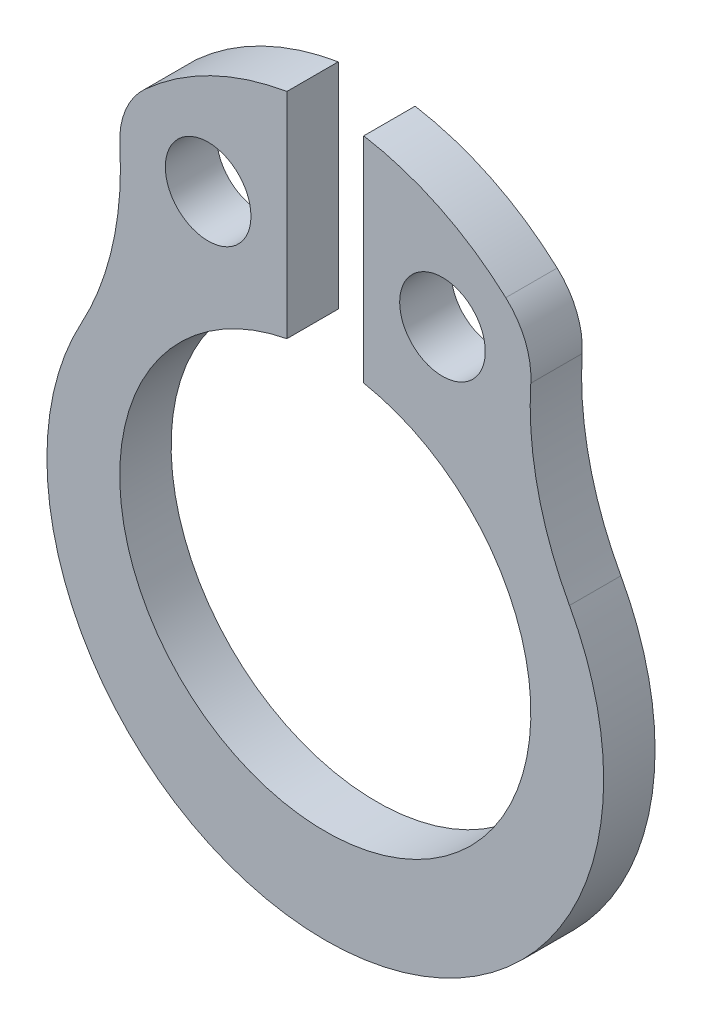
from build123d import *

# Parameters (mm, degrees)
SKETCH1_R           = 0.5
BOSS_EXTRUDE1_DEPTH = 0.3


with BuildPart() as part:
    # Sketch1 → Boss-Extrude1 (new, symmetric)
    with BuildSketch(Plane.XY):
        with BuildLine():
            Line((0.448644837, 4.857693324), (0.448644837, 2.357693324))
            ThreePointArc((0.448644837, 2.357693324), (0, -2.4), (-0.448644837, 2.357693324))
            Line((-0.448644837, 2.357693324), (-0.448644837, 4.857693324))
            ThreePointArc((-0.448644837, 4.857693324), (-1.335978352, 4.573676707), (-2.107001259, 4.050656745))
            ThreePointArc((-2.107001259, 4.050656745), (-2.334496109, 3.724141163), (-2.398824378, 3.331422173))
            ThreePointArc((-2.398824378, 3.331422173), (-2.482041728, 2.289018159), (-2.85085236, 1.310493774))
            ThreePointArc((-2.85085236, 1.310493774), (0, -3.5), (2.85085236, 1.310493774))
            ThreePointArc((2.85085236, 1.310493774), (2.482041728, 2.289018159), (2.398824378, 3.331422173))
            ThreePointArc((2.398824378, 3.331422173), (2.334496109, 3.724141163), (2.107001259, 4.050656745))
            ThreePointArc((2.107001259, 4.050656745), (1.335978352, 4.573676707), (0.448644837, 4.857693324))
        make_face()
        with Locations((-1.367999755, 3.386002894)):
            Circle(SKETCH1_R, mode=Mode.SUBTRACT)
        with Locations(Location((1.367999755, 3.386002894, 0), (0, 0, 180))):
            Circle(SKETCH1_R, mode=Mode.SUBTRACT)
    extrude(amount=BOSS_EXTRUDE1_DEPTH, both=True)


solid = part.part
